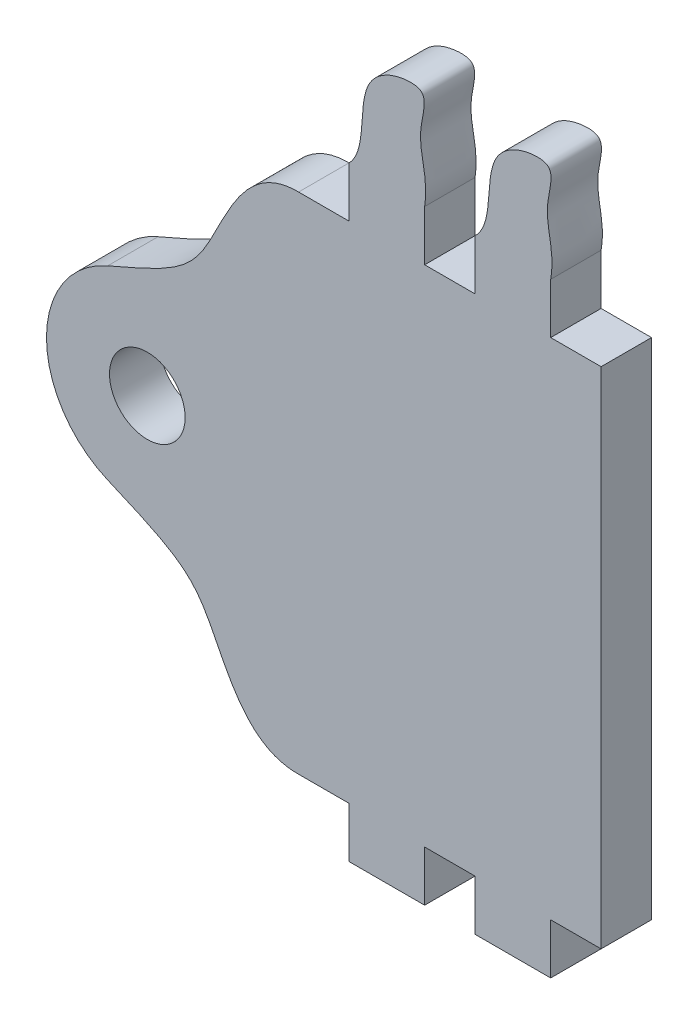
from build123d import *

# Parameters (mm, degrees)
SKETCH1_W           = 4.7625
SKETCH1_H           = 3.175
SKETCH1_R           = 2.38125
BOSS_EXTRUDE1_DEPTH = 3.175


with BuildPart() as part:
    # Sketch1 → Boss-Extrude1 (new body)
    # profile 1 of 9: a face of its own
    with BuildSketch(Plane.XY):
        Polygon((6.35, -15.875), (9.525, -15.875), (9.525, 15.875), (6.35, 15.875), (1.5875, 15.875), (-1.5875, 15.875), (-6.35, 15.875), (-9.525, 15.875), (-9.525, -15.875), (-6.35, -15.875), (-1.5875, -15.875), (1.5875, -15.875), align=None)
    # profile 2 of 9: a face of its own
    with BuildSketch(Plane.XY):
        with Locations((3.96875, -17.4625)):
            Rectangle(SKETCH1_W, SKETCH1_H)
    # profile 3 of 9: a face of its own
    with BuildSketch(Plane.XY):
        with Locations((3.96875, 17.4625)):
            Rectangle(SKETCH1_W, SKETCH1_H)
    # profile 4 of 9: a face of its own
    with BuildSketch(Plane.XY):
        with Locations((-3.96875, -17.4625)):
            Rectangle(SKETCH1_W, SKETCH1_H)
    # profile 5 of 9: a face of its own
    with BuildSketch(Plane.XY):
        with BuildLine():
            Line((1.5875, 19.05), (6.35, 19.05))
            add(Edge.make_bspline(
                [(1.5875, 19.05), (2.876060697, 20.282977256), (1.750876168, 23.717010334), (4.480105354, 25.343943309), (6.713969799, 25.323271855), (5.664629716, 22.075566326), (6.66156491, 20.85876393), (6.35, 19.05)],
                knots=[0, 0, 0, 0, 0.347503902, 0.512635707, 0.589513021, 0.712232462, 1, 1, 1, 1], degree=3))
        make_face()
    # profile 6 of 9: a face of its own
    with BuildSketch(Plane.XY):
        with Locations((-3.96875, 17.4625)):
            Rectangle(SKETCH1_W, SKETCH1_H)
    # profile 7 of 9: a face of its own
    with BuildSketch(Plane.XY):
        with BuildLine():
            add(Edge.make_bspline(
                [(-21.547594304, -5.838195157), (-17.741398311, -7.466495201), (-15.030939304, -8.836500628), (-13.009281216, -15.917091584), (-9.525, -15.875)],
                knots=[0, 0, 0, 0, 0.458191309, 1, 1, 1, 1], degree=3))
            Line((-9.525, -15.875), (-9.525, 15.875))
            add(Edge.make_bspline(
                [(-21.547594304, 5.838195157), (-17.741398311, 7.466495201), (-15.030939304, 8.836500628), (-13.009281216, 15.917091584), (-9.525, 15.875)],
                knots=[0, 0, 0, 0, 0.458191309, 1, 1, 1, 1], degree=3))
            ThreePointArc((-21.547594304, 5.838195157), (-15.552659856, 5.300104896), (-12.7, 0))
            ThreePointArc((-12.7, 0), (-15.552659856, -5.300104896), (-21.547594304, -5.838195157))
        make_face()
    # profile 8 of 9: a face of its own
    with BuildSketch(Plane.XY):
        with BuildLine():
            Line((-6.35, 19.05), (-1.5875, 19.05))
            add(Edge.make_bspline(
                [(-6.35, 19.05), (-5.108948033, 20.312838142), (-6.248797567, 23.782627537), (-3.504668245, 25.422749175), (-1.270595434, 25.401850486), (-2.33046195, 22.118193687), (-1.30296019, 20.902293296), (-1.5875, 19.05)],
                knots=[0, 0, 0, 0, 0.348300856, 0.511853831, 0.587996117, 0.709542233, 1, 1, 1, 1], degree=3))
        make_face()
    # profile 9 of 9: a face of its own
    with BuildSketch(Plane.XY):
        with BuildLine():
            ThreePointArc((-21.547594304, 5.838195157), (-25.4, 0), (-21.547594304, -5.838195157))
            ThreePointArc((-21.547594304, -5.838195157), (-15.552659856, -5.300104896), (-12.7, 0))
            ThreePointArc((-12.7, 0), (-15.552659856, 5.300104896), (-21.547594304, 5.838195157))
        make_face()
        with Locations((-19.05, 0)):
            Circle(SKETCH1_R, mode=Mode.SUBTRACT)
    extrude(amount=BOSS_EXTRUDE1_DEPTH)


solid = part.part
